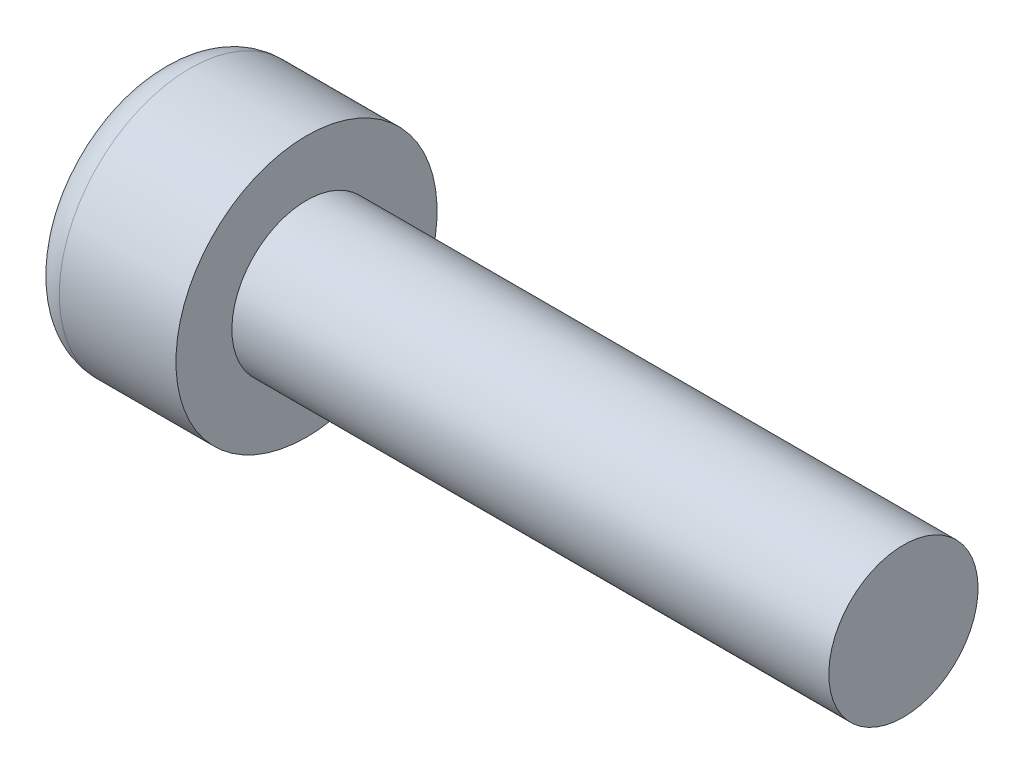
from build123d import *

# Parameters (mm, degrees)
CUT_EXTRUDE1_DEPTH = 2


with BuildPart() as part:
    # Sketch1 → Revolve1 (revolve)
    with BuildSketch(Plane.XY, mode=Mode.PRIVATE) as revolve1_sk:
        with BuildLine():
            Line((0, 0), (0, 2.625))
            ThreePointArc((0, 2.625), (0.256281566, 3.243718434), (0.875, 3.5))
            Line((0.875, 3.5), (4, 3.5))
            Line((4, 3.5), (4, 2))
            Line((4, 2), (20, 2))
            Line((20, 2), (20, 0))
            Line((20, 0), (0, 0))
        make_face()
    revolve(revolve1_sk.sketch.rotate(Axis((0, 0, 0), (1, 0, 0)), 180), axis=Axis((0, 0, 0), (1, 0, 0)))

    # Sketch2 → Cut-Extrude1 (cut)
    with BuildSketch(Plane.ZY):
        Polygon((0, 1.732050808), (-1.5, 0.866025404), (-1.5, -0.866025404), (0, -1.732050808), (1.5, -0.866025404), (1.5, 0.866025404), align=None)
    extrude(amount=-CUT_EXTRUDE1_DEPTH, mode=Mode.SUBTRACT)


solid = part.part
